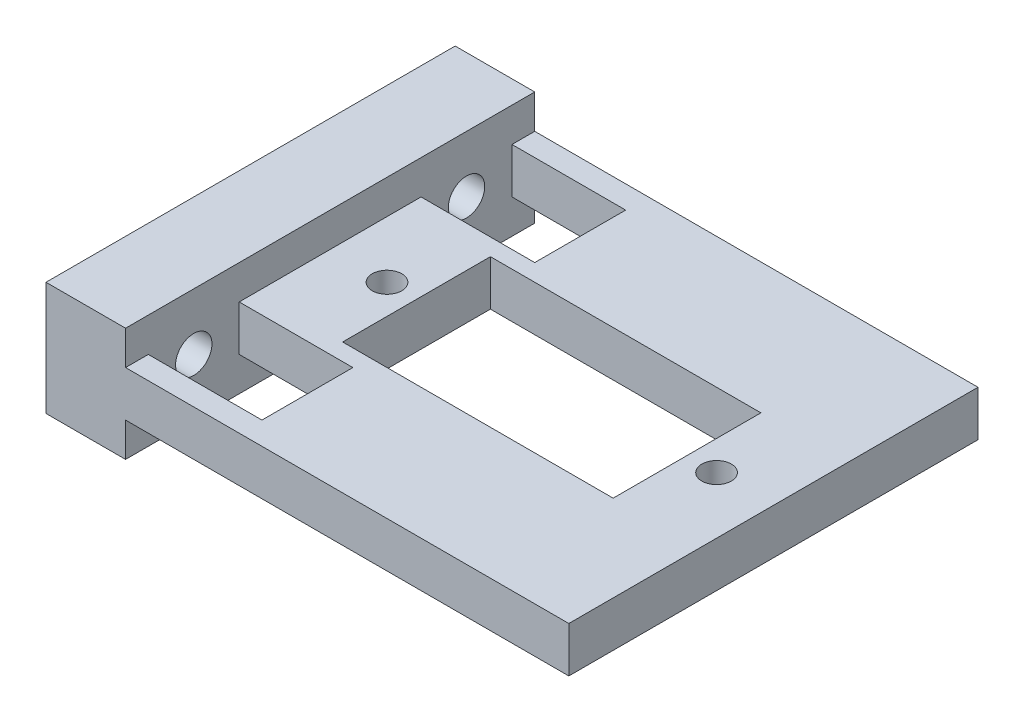
from build123d import *

# Parameters (mm, degrees)
SERVO_SHELF_START                = 26
SERVO_SHELF_PROFILE_W            = 46
SERVO_SHELF_PROFILE_H            = 36
SERVO_SHELF_DEPTH                = 4
REAR_CLAMPING_BLOCK_START        = -18
REAR_CLAMPING_BLOCK_PROFILE_W    = 7
REAR_CLAMPING_BLOCK_PROFILE_H    = 10
REAR_CLAMPING_BLOCK_DEPTH        = 36
SERVO_BODY_WINDOW_START          = 25
SERVO_BODY_WINDOW_PROFILE_W      = 23.8
SERVO_BODY_WINDOW_PROFILE_H      = 13
SERVO_BODY_WINDOW_DEPTH          = 21.144213361
YAW_SERVO_M2_FASTENERS_START     = 25
YAW_SERVO_M2_FASTENERS_PROFILE_R = 1.3
YAW_SERVO_M2_FASTENERS_DEPTH     = 21.144213361
LEFT_NUT_ACCESS_START            = 20
LEFT_NUT_ACCESS_PROFILE_W        = 10
LEFT_NUT_ACCESS_PROFILE_H        = 8
LEFT_NUT_ACCESS_DEPTH            = 26.144213361
RIGHT_NUT_ACCESS_START           = 20
RIGHT_NUT_ACCESS_PROFILE_W       = 10
RIGHT_NUT_ACCESS_PROFILE_H       = 8
RIGHT_NUT_ACCESS_DEPTH           = 26.144213361
REAR_CLAMPING_M3_HOLES_START     = -25
REAR_CLAMPING_M3_PROFILE_R       = 1.6
REAR_CLAMPING_M3_HOLES_DEPTH     = 11


with BuildPart() as part:
    # Servo_shelf_profile → Servo_shelf (new body)
    with BuildSketch(Plane(origin=(0, 0, 0), x_dir=(1, 0, 0), z_dir=(0, 1, 0)).offset(SERVO_SHELF_START)):
        with Locations((2, 0)):
            Rectangle(SERVO_SHELF_PROFILE_W, SERVO_SHELF_PROFILE_H)
    extrude(amount=SERVO_SHELF_DEPTH)

    # Rear_clamping_block_profile → Rear_clamping_block (add)
    with BuildSketch(Plane.XY.offset(REAR_CLAMPING_BLOCK_START)):
        with Locations((-17.5, 28)):
            Rectangle(REAR_CLAMPING_BLOCK_PROFILE_W, REAR_CLAMPING_BLOCK_PROFILE_H)
    extrude(amount=REAR_CLAMPING_BLOCK_DEPTH)

    # Servo_body_window_profile → Servo_body_window (cut, through all)
    with BuildSketch(Plane(origin=(0, 0, 0), x_dir=(1, 0, 0), z_dir=(0, 1, 0)).offset(SERVO_BODY_WINDOW_START)):
        with Locations((5.5, 0)):
            Rectangle(SERVO_BODY_WINDOW_PROFILE_W, SERVO_BODY_WINDOW_PROFILE_H)
    extrude(amount=SERVO_BODY_WINDOW_DEPTH, mode=Mode.SUBTRACT)

    # Yaw_servo_M2_fasteners_profile → Yaw_servo_M2_fasteners (cut, through all)
    with BuildSketch(Plane(origin=(0, 0, 0), x_dir=(1, 0, 0), z_dir=(0, 1, 0)).offset(YAW_SERVO_M2_FASTENERS_START)):
        with Locations(Location((-9, 0, 0), (0, 0, 90))):
            Circle(YAW_SERVO_M2_FASTENERS_PROFILE_R)
        with Locations(Location((20, 0, 0), (0, 0, 90))):
            Circle(YAW_SERVO_M2_FASTENERS_PROFILE_R)
    extrude(amount=YAW_SERVO_M2_FASTENERS_DEPTH, mode=Mode.SUBTRACT)

    # Left_nut_access_profile → Left_nut_access (cut, through all)
    with BuildSketch(Plane(origin=(0, 0, 0), x_dir=(1, 0, 0), z_dir=(0, 1, 0)).offset(LEFT_NUT_ACCESS_START)):
        with Locations((-9, 12)):
            Rectangle(LEFT_NUT_ACCESS_PROFILE_W, LEFT_NUT_ACCESS_PROFILE_H)
    extrude(amount=LEFT_NUT_ACCESS_DEPTH, mode=Mode.SUBTRACT)

    # Right_nut_access_profile → Right_nut_access (cut, through all)
    with BuildSketch(Plane(origin=(0, 0, 0), x_dir=(1, 0, 0), z_dir=(0, 1, 0)).offset(RIGHT_NUT_ACCESS_START)):
        with Locations((-9, -12)):
            Rectangle(RIGHT_NUT_ACCESS_PROFILE_W, RIGHT_NUT_ACCESS_PROFILE_H)
    extrude(amount=RIGHT_NUT_ACCESS_DEPTH, mode=Mode.SUBTRACT)

    # Rear_clamping_M3_profile → Rear_clamping_M3_holes (cut)
    with BuildSketch(Plane(origin=(0, 0, 0), x_dir=(0, 0, -1), z_dir=(1, 0, 0)).offset(REAR_CLAMPING_M3_HOLES_START)):
        with Locations((12, 28)):
            Circle(REAR_CLAMPING_M3_PROFILE_R)
        with Locations((-12, 28)):
            Circle(REAR_CLAMPING_M3_PROFILE_R)
    extrude(amount=REAR_CLAMPING_M3_HOLES_DEPTH, mode=Mode.SUBTRACT)


solid = part.part
